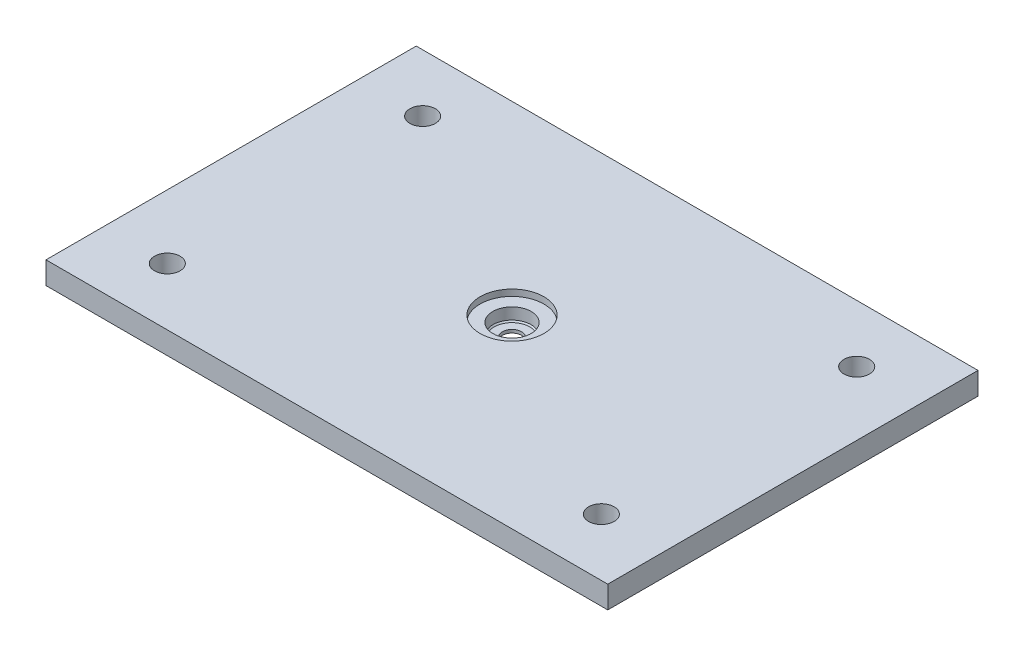
from build123d import *

# Parameters (mm, degrees)
SKETCH1_W           = 880
SKETCH1_H           = 580
BOSS_EXTRUDE1_DEPTH = 35
SKETCH2_R           = 50
CUT_EXTRUDE1_DEPTH  = 10
SKETCH3_R           = 30
CUT_EXTRUDE2_DEPTH  = 20
SKETCH4_R           = 15
CUT_EXTRUDE3_DEPTH  = 522
CHAMFER1_SIZE       = 2
SKETCH5_R           = 20
CUT_EXTRUDE4_DEPTH  = 450


with BuildPart() as part:
    # Sketch1 → Boss-Extrude1 (new body)
    with BuildSketch(Plane(origin=(0, 0, 0), x_dir=(1, 0, 0), z_dir=(0, 1, 0))):
        Rectangle(SKETCH1_W, SKETCH1_H)
    extrude(amount=BOSS_EXTRUDE1_DEPTH)

    # Sketch2 → Cut-Extrude1 (cut)
    with BuildSketch(Plane(origin=(0, 35, 0), x_dir=(1, 0, 0), z_dir=(0, 1, 0))):
        with Locations(Location((0, 0, 0), (0, 0, 270))):
            Circle(SKETCH2_R)
    extrude(amount=-CUT_EXTRUDE1_DEPTH, mode=Mode.SUBTRACT)

    # Sketch3 → Cut-Extrude2 (cut)
    with BuildSketch(Plane(origin=(0, 25, 0), x_dir=(1, 0, 0), z_dir=(0, 1, 0))):
        with Locations(Location((0, 0, 0), (0, 0, 270))):
            Circle(SKETCH3_R)
    extrude(amount=-CUT_EXTRUDE2_DEPTH, mode=Mode.SUBTRACT)

    # Sketch4 → Cut-Extrude3 (cut)
    with BuildSketch(Plane(origin=(0, 5, 0), x_dir=(1, 0, 0), z_dir=(0, 1, 0))):
        with Locations(Location((0, 0, 0), (0, 0, 270))):
            Circle(SKETCH4_R)
    extrude(amount=-CUT_EXTRUDE3_DEPTH, mode=Mode.SUBTRACT)

    # Chamfer1
    chamfer1_edges = [part.edges().sort_by_distance(p)[0] for p in [
        (0, 5, -30),
    ]]
    chamfer(chamfer1_edges, length=CHAMFER1_SIZE)

    # Sketch5 → Cut-Extrude4 (cut)
    with BuildSketch(Plane(origin=(0, 35, 0), x_dir=(1, 0, 0), z_dir=(0, 1, 0))):
        with Locations(Location((-340, 200, 0), (0, 0, 270))):
            Circle(SKETCH5_R)
        with Locations(Location((340, 200, 0), (0, 0, 270))):
            Circle(SKETCH5_R)
        with Locations(Location((340, -200, 0), (0, 0, 270))):
            Circle(SKETCH5_R)
        with Locations(Location((-340, -200, 0), (0, 0, 270))):
            Circle(SKETCH5_R)
    extrude(amount=-CUT_EXTRUDE4_DEPTH, mode=Mode.SUBTRACT)


solid = part.part
